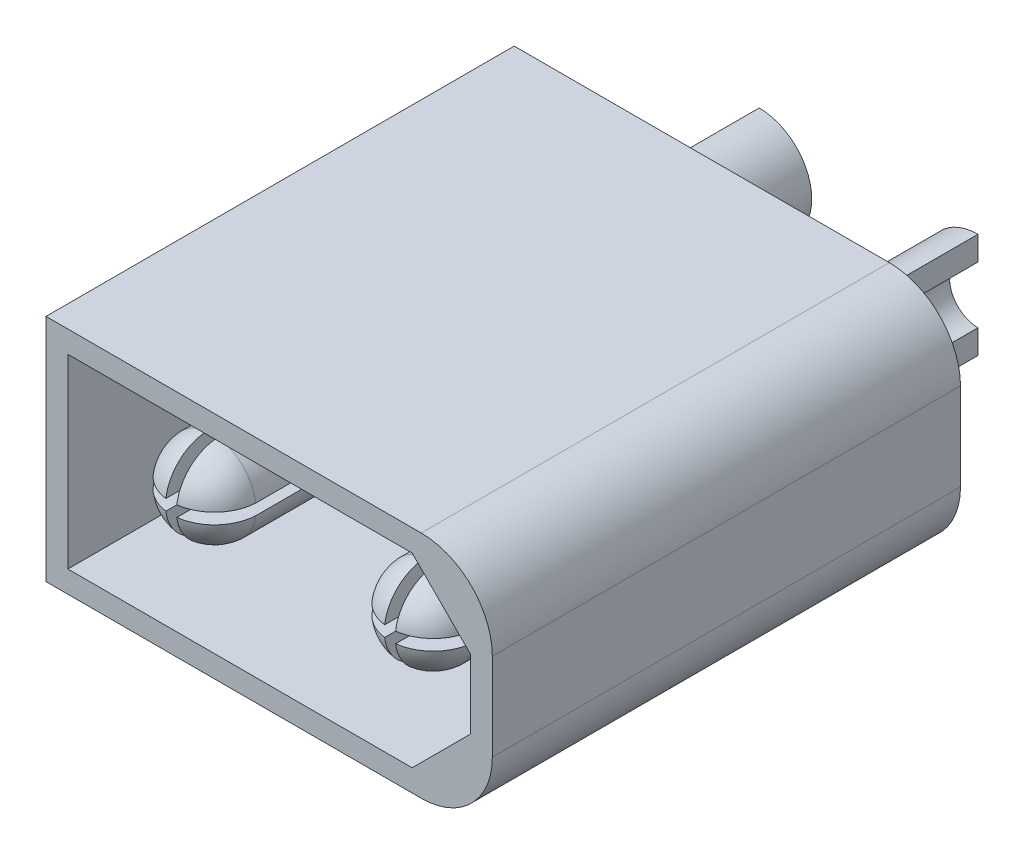
from build123d import *

# Parameters (mm, degrees)
BOSS_EXTRUDE1_DEPTH   = 10.7
SKETCH1_4_R           = 1
BOSS_EXTRUDE5_DEPTH   = 9.5
BOSS_EXTRUDE5_2_DEPTH = 9.5
BOSS_EXTRUDE3_DEPTH   = 2.5
DOME1_FACE_RADIUS     = 1
DOME1_HEIGHT          = 0.95
DOME2_FACE_RADIUS     = 1
DOME2_HEIGHT          = 0.95
CUT_EXTRUDE1_DEPTH    = 13.121494339
SKETCH5_R             = 1.2
BOSS_EXTRUDE6_DEPTH   = 6.5
SKETCH6_R             = 0.65
CUT_EXTRUDE2_DEPTH    = 4
CUT_EXTRUDE3_START    = -2.34
CUT_EXTRUDE3_DEPTH    = 2.34


with BuildPart() as part:
    # Sketch1 → Boss-Extrude1 (new body)
    with BuildSketch(Plane.XY):
        with BuildLine():
            Line((0, -2.625), (0, 2.625))
            Line((0, 2.625), (8.575, 2.625))
            ThreePointArc((8.575, 2.625), (9.724048519, 2.149048519), (10.2, 1))
            Line((10.2, 1), (10.2, -1))
            ThreePointArc((10.2, -1), (9.724048519, -2.149048519), (8.575, -2.625))
            Line((8.575, -2.625), (0, -2.625))
        make_face()
        Polygon((0.5, -2.125), (8.367893219, -2.125), (9.7, -0.792893219), (9.7, 0.792893219), (8.367893219, 2.125), (0.5, 2.125), align=None, mode=Mode.SUBTRACT)
    extrude(amount=BOSS_EXTRUDE1_DEPTH)

    # Sketch3 → Boss-Extrude3 (add)
    with BuildSketch(Plane(origin=(0, 0, 1), x_dir=(-1, 0, 0), z_dir=(0, 0, -1))):
        Polygon((-0.5, -2.125), (-0.5, 2.125), (-8.367893219, 2.125), (-9.7, 0.792893219), (-9.7, -0.792893219), (-8.367893219, -2.125), align=None)
    extrude(amount=-BOSS_EXTRUDE3_DEPTH)



with BuildPart() as body_2:
    # Sketch1<4> → Boss-Extrude5 (new body)
    with BuildSketch(Plane.XY):
        with Locations((2.6, 0)):
            Circle(SKETCH1_4_R)
    extrude(amount=BOSS_EXTRUDE5_DEPTH)

    # Dome2: a dome of height H over a round flat face of radius A is a cap of a sphere of radius (A * A + H * H) / (2 * H)
    dome2_r = (DOME2_FACE_RADIUS * DOME2_FACE_RADIUS + DOME2_HEIGHT * DOME2_HEIGHT) / (2 * DOME2_HEIGHT)
    dome2_base = Plane((2.6, 0, 9.5), z_dir=(0, 0, 1))
    with Locations(dome2_base.offset(DOME2_HEIGHT - dome2_r)):
        dome2_ball = Sphere(dome2_r, mode=Mode.PRIVATE)
    add(split(dome2_ball, bisect_by=dome2_base, keep=Keep.TOP, mode=Mode.PRIVATE))


with BuildPart() as body_3:
    # Sketch1<4> → Boss-Extrude5 2 (new body)
    with BuildSketch(Plane.XY):
        with Locations(Location((7.6, 0, 0), (0, 0, 180))):
            Circle(SKETCH1_4_R)
    extrude(amount=BOSS_EXTRUDE5_2_DEPTH)

    # Dome1: a dome of height H over a round flat face of radius A is a cap of a sphere of radius (A * A + H * H) / (2 * H)
    dome1_r = (DOME1_FACE_RADIUS * DOME1_FACE_RADIUS + DOME1_HEIGHT * DOME1_HEIGHT) / (2 * DOME1_HEIGHT)
    dome1_base = Plane((7.6, 0, 9.5), z_dir=(0, 0, 1))
    with Locations(dome1_base.offset(DOME1_HEIGHT - dome1_r)):
        dome1_ball = Sphere(dome1_r, mode=Mode.PRIVATE)
    add(split(dome1_ball, bisect_by=dome1_base, keep=Keep.TOP, mode=Mode.PRIVATE))


with BuildPart() as cut_extrude1_tool:
    # Sketch4 → Cut-Extrude1 (new, through all)
    with BuildSketch(Plane.XY.offset(6)):
        with BuildLine():
            Line((7.475, 0.992156742), (7.475, 0.125))
            Line((7.475, 0.125), (6.607843258, 0.125))
            ThreePointArc((6.607843258, 0.125), (6.6, 0), (6.607843258, -0.125))
            Line((6.607843258, -0.125), (7.475, -0.125))
            Line((7.475, -0.125), (7.475, -0.992156742))
            ThreePointArc((7.475, -0.992156742), (7.6, -1), (7.725, -0.992156742))
            Line((7.725, -0.992156742), (7.725, -0.125))
            Line((7.725, -0.125), (8.592156742, -0.125))
            ThreePointArc((8.592156742, -0.125), (8.6, 0), (8.592156742, 0.125))
            Line((8.592156742, 0.125), (7.725, 0.125))
            Line((7.725, 0.125), (7.725, 0.992156742))
            ThreePointArc((7.725, 0.992156742), (7.6, 1), (7.475, 0.992156742))
        make_face()
        with BuildLine():
            Line((3.592156742, -0.125), (2.725, -0.125))
            Line((2.725, -0.125), (2.725, -0.992156742))
            ThreePointArc((2.725, -0.992156742), (2.6, -1), (2.475, -0.992156742))
            Line((2.475, -0.992156742), (2.475, -0.125))
            Line((2.475, -0.125), (1.607843258, -0.125))
            ThreePointArc((1.607843258, -0.125), (1.6, 0), (1.607843258, 0.125))
            Line((1.607843258, 0.125), (2.475, 0.125))
            Line((2.475, 0.125), (2.475, 0.992156742))
            ThreePointArc((2.475, 0.992156742), (2.6, 1), (2.725, 0.992156742))
            Line((2.725, 0.992156742), (2.725, 0.125))
            Line((2.725, 0.125), (3.592156742, 0.125))
            ThreePointArc((3.592156742, 0.125), (3.6, 0), (3.592156742, -0.125))
        make_face()
    extrude(amount=CUT_EXTRUDE1_DEPTH)


with BuildPart() as body_2_1:
    add(body_2.part)

    # Cut-Extrude1: cut by cut_extrude1_tool
    add(cut_extrude1_tool.part, mode=Mode.SUBTRACT)


with BuildPart() as body_3_1:
    add(body_3.part)

    # Cut-Extrude1: cut by cut_extrude1_tool
    add(cut_extrude1_tool.part, mode=Mode.SUBTRACT)


with BuildPart() as part_1:
    add(part.part)

    add(body_2_1.part)  # Boss-Extrude6 merges body 2

    add(body_3_1.part)  # Boss-Extrude6 merges body 3
    # Sketch5 → Boss-Extrude6 (add)
    with BuildSketch(Plane.XY.offset(3.5)):
        with Locations((7.6, 0)):
            Circle(SKETCH5_R)
        with Locations((2.6, 0)):
            Circle(SKETCH5_R)
    extrude(amount=-BOSS_EXTRUDE6_DEPTH)

    # Sketch6 → Cut-Extrude2 (cut)
    with BuildSketch(Plane(origin=(0, 0, -3), x_dir=(-1, 0, 0), z_dir=(0, 0, -1))):
        with Locations((-2.6, 0)):
            Circle(SKETCH6_R)
        with Locations((-7.6, 0)):
            Circle(SKETCH6_R)
    extrude(amount=-CUT_EXTRUDE2_DEPTH, mode=Mode.SUBTRACT)

    # Sketch7 → Cut-Extrude3 (cut)
    with BuildSketch(Plane(origin=(0, 0, -3), x_dir=(-1, 0, 0), z_dir=(0, 0, -1)).offset(CUT_EXTRUDE3_START)):
        with BuildLine():
            Line((-2.6, -0.65), (-2.6, -1.2))
            ThreePointArc((-2.6, -1.2), (-1.751471863, -0.848528137), (-1.4, 0))
            ThreePointArc((-1.4, 0), (-1.751471863, 0.848528137), (-2.6, 1.2))
            Line((-2.6, 1.2), (-2.6, 0.65))
            ThreePointArc((-2.6, 0.65), (-2.140380592, 0.459619408), (-1.95, 0))
            ThreePointArc((-1.95, 0), (-2.140380592, -0.459619408), (-2.6, -0.65))
        make_face()
        with BuildLine():
            ThreePointArc((-7.6, 1.2), (-8.8, 0), (-7.6, -1.2))
            Line((-7.6, -1.2), (-7.6, 1.2))
        make_face()
    extrude(amount=CUT_EXTRUDE3_DEPTH, mode=Mode.SUBTRACT)


solid = part_1.part
